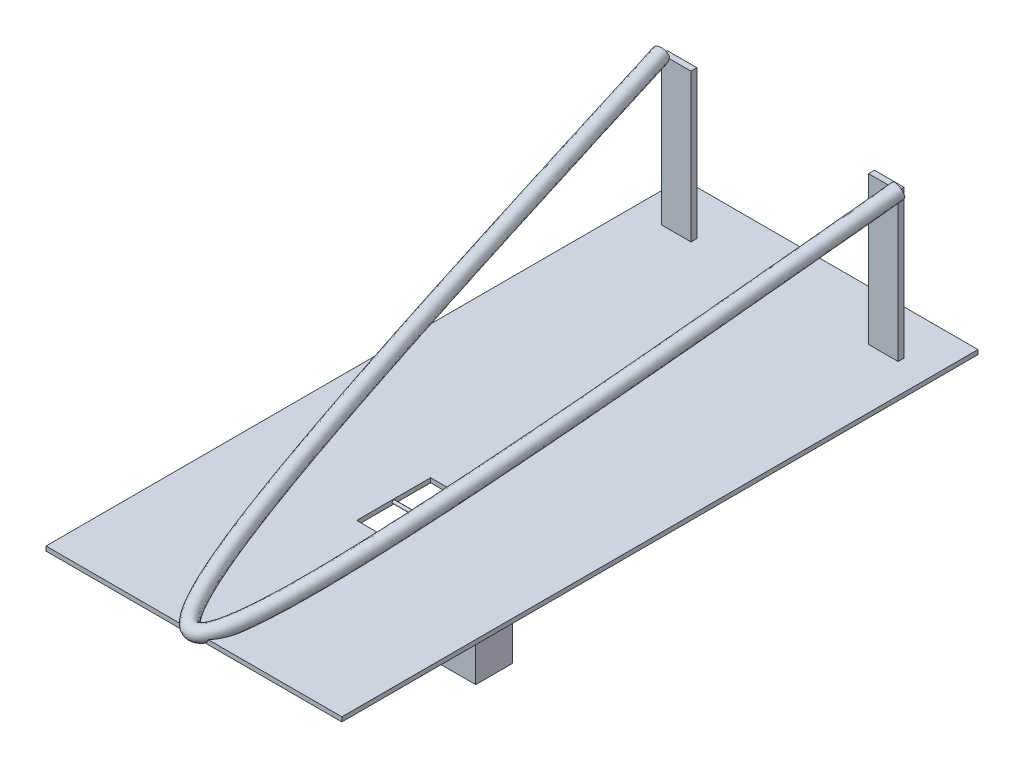
from build123d import *

# Parameters (mm, degrees)
ESQUISSE1_W             = 200
ESQUISSE1_H             = 430
BOSS_EXTRU_1_DEPTH      = 3
ESQUISSE2_W             = 20
ESQUISSE2_H             = 4
BOSS_EXTRU_2_DEPTH      = 100
ESQUISSE3_W             = 20
ESQUISSE3_H             = 50
ENL_V_MAT_EXTRU_1_DEPTH = 485.664832642
ESQUISSE4_R             = 1
BOSS_EXTRU_3_DEPTH      = 20
ESQUISSE5_W             = 43.926963767
ESQUISSE5_H             = 24.807216862
BOSS_EXTRU_4_DEPTH      = 50
ESQUISSE6_W             = 10
ESQUISSE6_H             = 10
BOSS_EXTRU_5_DEPTH      = 10
BALAYAGE1_PROFILE_R     = 5


with BuildPart() as part:
    # Esquisse1 → Boss.-Extru.1 (new body)
    with BuildSketch(Plane(origin=(0, 0, 0), x_dir=(1, 0, 0), z_dir=(0, 1, 0))):
        with Locations((100, 215)):
            Rectangle(ESQUISSE1_W, ESQUISSE1_H)
    extrude(amount=BOSS_EXTRU_1_DEPTH)

    # Esquisse2 → Boss.-Extru.2 (add)
    with BuildSketch(Plane(origin=(0, 3, 0), x_dir=(1, 0, 0), z_dir=(0, 1, 0))):
        with Locations((170, 398)):
            Rectangle(ESQUISSE2_W, ESQUISSE2_H)
        with Locations((30, 398)):
            Rectangle(ESQUISSE2_W, ESQUISSE2_H)
    extrude(amount=BOSS_EXTRU_2_DEPTH)

    # Esquisse3 → Enlèv. mat.-Extru.1 (cut, through all)
    with BuildSketch(Plane(origin=(0, 3, 0), x_dir=(1, 0, 0), z_dir=(0, 1, 0))):
        with Locations((100, 145)):
            Rectangle(ESQUISSE3_W, ESQUISSE3_H)
    extrude(amount=-ENL_V_MAT_EXTRU_1_DEPTH, mode=Mode.SUBTRACT)

    # Esquisse4 → Boss.-Extru.3 (add)
    with BuildSketch(Plane.ZY.offset(-110)):
        with Locations(Location((-145, 1.5, 0), (0, 0, 180))):
            Circle(ESQUISSE4_R)
    extrude(amount=BOSS_EXTRU_3_DEPTH)

    # Esquisse5 → Boss.-Extru.4 (add)
    with BuildSketch(Plane.XZ):
        with Locations((151.442146831, -129.446960812)):
            Rectangle(ESQUISSE5_W, ESQUISSE5_H)
    extrude(amount=BOSS_EXTRU_4_DEPTH)

    # Esquisse6 → Boss.-Extru.5 (add)
    with BuildSketch(Plane(origin=(0, 0, -141.850569243), x_dir=(-1, 0, 0), z_dir=(0, 0, -1))):
        with Locations((-134.478664948, -19.376311364)):
            Rectangle(ESQUISSE6_W, ESQUISSE6_H)
    extrude(amount=BOSS_EXTRU_5_DEPTH)

    # Balayage1: sweep along a curve in space
    with BuildLine() as balayage1_path:
        add(Edge.make_bspline(
            [(180, 103, -396), (153.333333333, 53, -198), (100, -47, 198), (46.666666667, 53, -198), (20, 103, -396)],
            knots=[0, 0, 0, 0, 0.5, 1, 1, 1, 1], degree=3))
    # Balayage1 profile (on start of the path) → Balayage1 (sweep)
    with BuildSketch(Plane(origin=(180, 103, -396), x_dir=(0, 0.9695636708716765, 0.24483931082618096), z_dir=(-0.12948171044229212, -0.24277820707929756, 0.9614017000340181))):
        Circle(BALAYAGE1_PROFILE_R)
    sweep(path=balayage1_path.line)


solid = part.part
